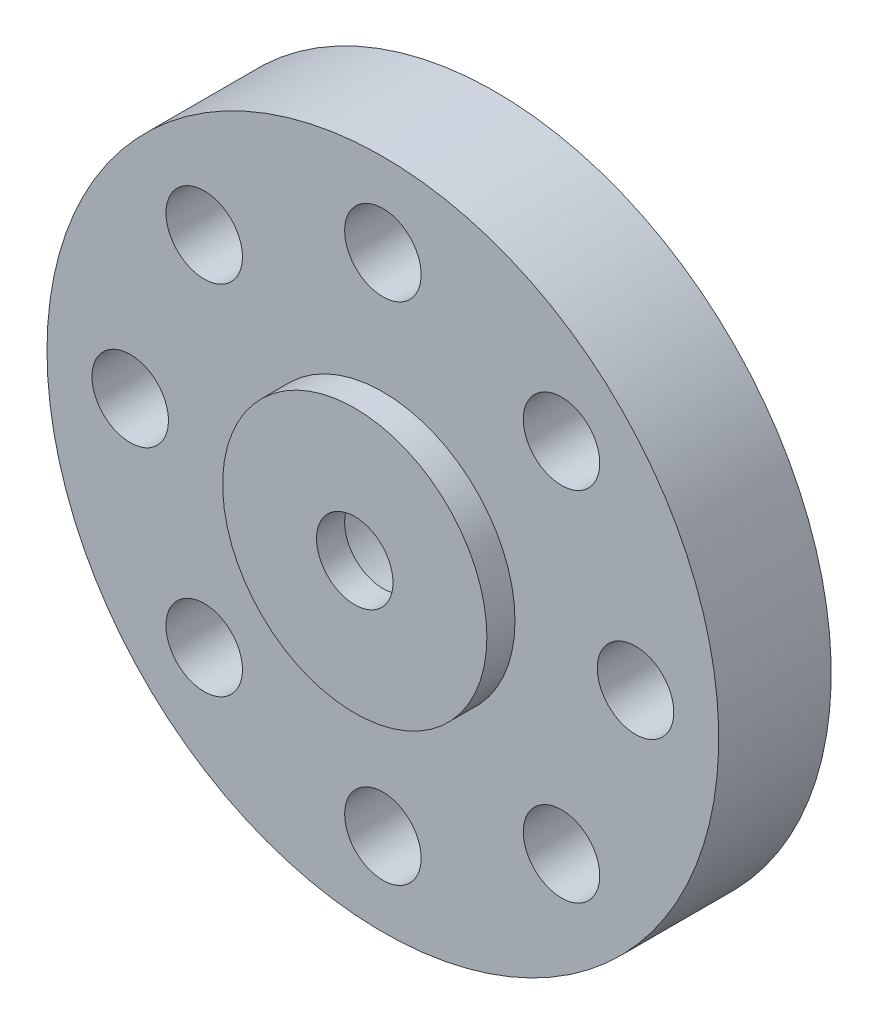
from build123d import *

# Parameters (mm, degrees)
SKETCH1_R           = 5.875
SKETCH1_R_2         = 1.7
BOSS_EXTRUDE1_DEPTH = 1.25
SKETCH2_R           = 14.935
SKETCH2_R_2         = 1.7
SKETCH2_R_3         = 3.220003918
BOSS_EXTRUDE2_DEPTH = 5


with BuildPart() as part:
    # Sketch1 → Boss-Extrude1 (new body)
    with BuildSketch(Plane.XY):
        with Locations((19.5, 0)):
            Circle(SKETCH1_R)
        with Locations((19.5, 0)):
            Circle(SKETCH1_R_2, mode=Mode.SUBTRACT)
    extrude(amount=-BOSS_EXTRUDE1_DEPTH)

    # Sketch2 → Boss-Extrude2 (add)
    with BuildSketch(Plane(origin=(0, 0, -1.25), x_dir=(-1, 0, 0), z_dir=(0, 0, -1))):
        with Locations((-19.5, 0)):
            Circle(SKETCH2_R)
        with Locations((-19.5, -11.235)):
            Circle(SKETCH2_R_2, mode=Mode.SUBTRACT)
        with Locations((-19.5, 0)):
            Circle(SKETCH2_R_3, mode=Mode.SUBTRACT)
        with Locations((-27.444344687, -7.944344687)):
            Circle(SKETCH2_R_2, mode=Mode.SUBTRACT)
        with Locations((-30.735, 0)):
            Circle(SKETCH2_R_2, mode=Mode.SUBTRACT)
        with Locations((-27.444344687, 7.944344686)):
            Circle(SKETCH2_R_2, mode=Mode.SUBTRACT)
        with Locations((-19.5, 11.235)):
            Circle(SKETCH2_R_2, mode=Mode.SUBTRACT)
        with Locations((-11.555655313, 7.944344686)):
            Circle(SKETCH2_R_2, mode=Mode.SUBTRACT)
        with Locations((-8.265, 0)):
            Circle(SKETCH2_R_2, mode=Mode.SUBTRACT)
        with Locations((-11.555655313, -7.944344687)):
            Circle(SKETCH2_R_2, mode=Mode.SUBTRACT)
    extrude(amount=BOSS_EXTRUDE2_DEPTH)


solid = part.part
